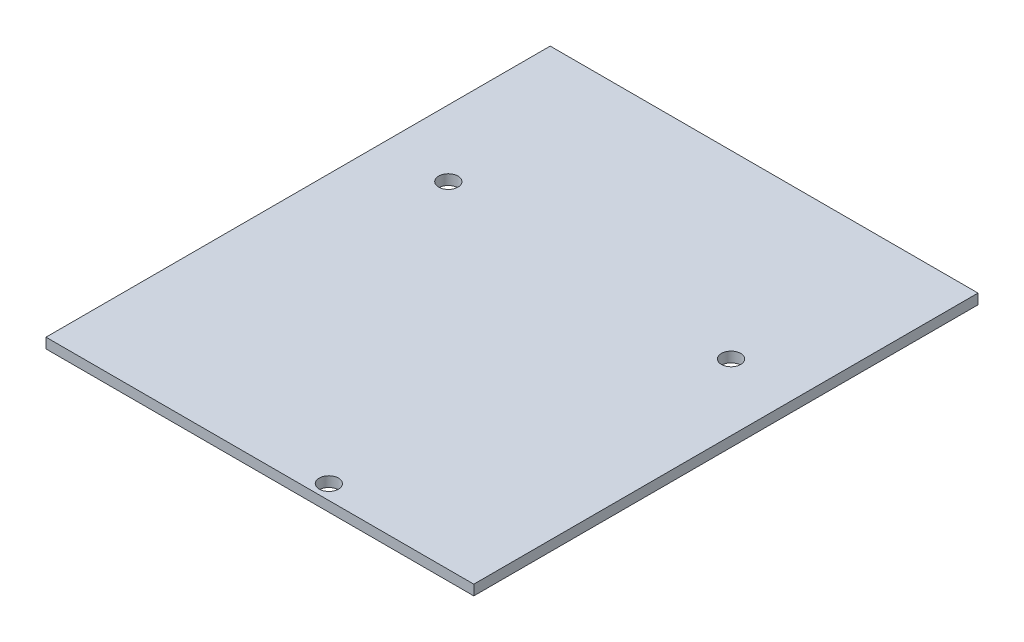
from build123d import *

# Parameters (mm, degrees)
SKETCH1_W           = 70
SKETCH1_H           = 82.5
SKETCH1_R           = 1.575
BOSS_EXTRUDE1_DEPTH = 1.67


with BuildPart() as part:
    # Sketch1 → Boss-Extrude1 (new body)
    with BuildSketch(Plane(origin=(0, 0, 0), x_dir=(1, 0, 0), z_dir=(0, 1, 0))):
        with Locations((4.24556213, -7.906804734)):
            Rectangle(SKETCH1_W, SKETCH1_H)
        with Locations(Location((13.13556213, -46.766804734, 0), (0, 0, 270))):
            Circle(SKETCH1_R, mode=Mode.SUBTRACT)
        with Locations(Location((-19.88443787, 5.803195266, 0), (0, 0, 270))):
            Circle(SKETCH1_R, mode=Mode.SUBTRACT)
        with Locations(Location((28.37556213, 3.803195266, 0), (0, 0, 270))):
            Circle(SKETCH1_R, mode=Mode.SUBTRACT)
    extrude(amount=BOSS_EXTRUDE1_DEPTH)


solid = part.part
